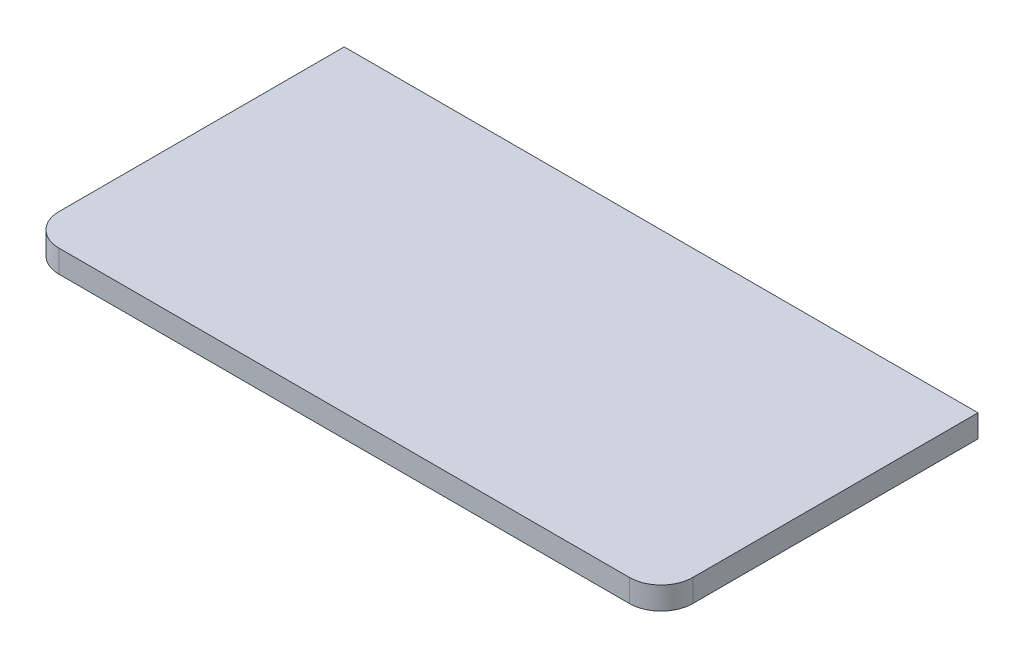
from build123d import *

# Parameters (mm, degrees)
SKETCH1_W           = 280
SKETCH1_H           = 140
BOSS_EXTRUDE1_DEPTH = 10
FILLET1_R           = 14


with BuildPart() as part:
    # Sketch1 → Boss-Extrude1 (new body)
    with BuildSketch(Plane(origin=(0, 0, 0), x_dir=(1, 0, 0), z_dir=(0, 1, 0))):
        Rectangle(SKETCH1_W, SKETCH1_H)
    extrude(amount=BOSS_EXTRUDE1_DEPTH)

    # Fillet1
    fillet1_edges = [part.edges().sort_by_distance(p)[0] for p in [
        (140, 5, 70),
        (-140, 5, 70),
    ]]
    fillet(fillet1_edges, radius=FILLET1_R)


solid = part.part
